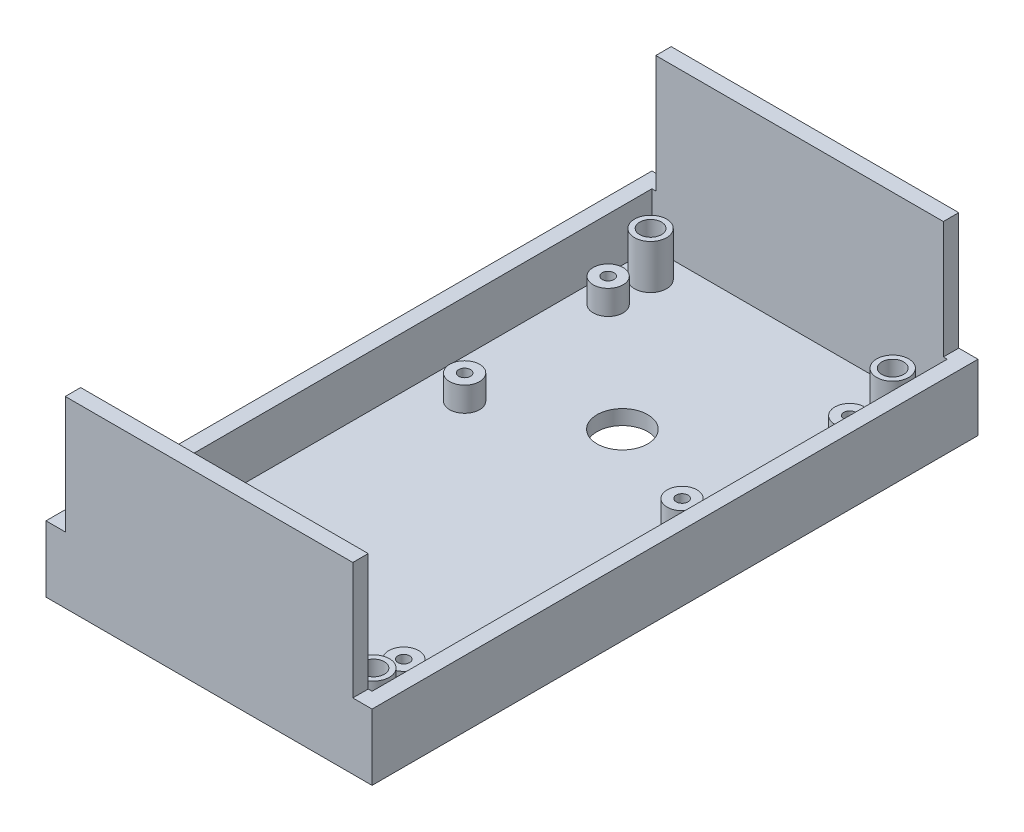
from build123d import *

# Parameters (mm, degrees)
SKETCH1_W           = 64.516
SKETCH1_H           = 119.888
BOSS_EXTRUDE1_DEPTH = 13.081
SKETCH2_W           = 58.42
SKETCH2_H           = 113.792
CUT_EXTRUDE1_DEPTH  = 10.16
SKETCH3_W           = 56.896
SKETCH3_H           = 3.048
BOSS_EXTRUDE2_DEPTH = 23.2156
SKETCH4_R           = 2.9591
SKETCH4_R_2         = 1.1684
BOSS_EXTRUDE3_DEPTH = 4.826
SKETCH5_R           = 5.0165
CUT_EXTRUDE2_DEPTH  = 141.176237199
SKETCH6_R           = 3.175
SKETCH6_R_2         = 2.159
BOSS_EXTRUDE4_DEPTH = 8.763
SKETCH6_2_R         = 2.159
CUT_EXTRUDE3_DEPTH  = 141.176237199


with BuildPart() as part:
    # Sketch1 → Boss-Extrude1 (new body)
    with BuildSketch(Plane(origin=(0, 0, 0), x_dir=(1, 0, 0), z_dir=(0, 1, 0))):
        with Locations((32.258, 59.944)):
            Rectangle(SKETCH1_W, SKETCH1_H)
    extrude(amount=BOSS_EXTRUDE1_DEPTH)

    # Sketch2 → Cut-Extrude1 (cut)
    with BuildSketch(Plane(origin=(0, 13.081, 0), x_dir=(1, 0, 0), z_dir=(0, 1, 0))):
        with Locations((32.258, 59.944)):
            Rectangle(SKETCH2_W, SKETCH2_H)
    extrude(amount=-CUT_EXTRUDE1_DEPTH, mode=Mode.SUBTRACT)

    # Sketch3 → Boss-Extrude2 (add)
    with BuildSketch(Plane(origin=(0, 13.081, 0), x_dir=(1, 0, 0), z_dir=(0, 1, 0))):
        with Locations((32.258, 118.364)):
            Rectangle(SKETCH3_W, SKETCH3_H)
        with Locations((32.258, 1.524)):
            Rectangle(SKETCH3_W, SKETCH3_H)
    extrude(amount=BOSS_EXTRUDE2_DEPTH)

    # Sketch4 → Boss-Extrude3 (add)
    # profile 1 of 6: a face of its own
    with BuildSketch(Plane(origin=(0, 2.921, 0), x_dir=(1, 0, 0), z_dir=(0, 1, 0))):
        with Locations((8.3566, 102.87)):
            Circle(SKETCH4_R)
        with Locations((8.3566, 102.87)):
            Circle(SKETCH4_R_2, mode=Mode.SUBTRACT)
    # profile 2 of 6: a face of its own
    with BuildSketch(Plane(origin=(0, 2.921, 0), x_dir=(1, 0, 0), z_dir=(0, 1, 0))):
        with Locations((56.1594, 102.87)):
            Circle(SKETCH4_R)
        with Locations((56.1594, 102.87)):
            Circle(SKETCH4_R_2, mode=Mode.SUBTRACT)
    # profile 3 of 6: a face of its own
    with BuildSketch(Plane(origin=(0, 2.921, 0), x_dir=(1, 0, 0), z_dir=(0, 1, 0))):
        with Locations((10.7442, 72.0852)):
            Circle(SKETCH4_R)
        with Locations((10.7442, 72.0852)):
            Circle(SKETCH4_R_2, mode=Mode.SUBTRACT)
    # profile 4 of 6: a face of its own
    with BuildSketch(Plane(origin=(0, 2.921, 0), x_dir=(1, 0, 0), z_dir=(0, 1, 0))):
        with Locations((53.7718, 72.0852)):
            Circle(SKETCH4_R)
        with Locations((53.7718, 72.0852)):
            Circle(SKETCH4_R_2, mode=Mode.SUBTRACT)
    # profile 5 of 6: a face of its own
    with BuildSketch(Plane(origin=(0, 2.921, 0), x_dir=(1, 0, 0), z_dir=(0, 1, 0))):
        with Locations((10.7442, 17.018)):
            Circle(SKETCH4_R)
        with Locations((10.7442, 17.018)):
            Circle(SKETCH4_R_2, mode=Mode.SUBTRACT)
    # profile 6 of 6: a face of its own
    with BuildSketch(Plane(origin=(0, 2.921, 0), x_dir=(1, 0, 0), z_dir=(0, 1, 0))):
        with Locations((53.7718, 17.018)):
            Circle(SKETCH4_R)
        with Locations((53.7718, 17.018)):
            Circle(SKETCH4_R_2, mode=Mode.SUBTRACT)
    extrude(amount=BOSS_EXTRUDE3_DEPTH)

    # Sketch5 → Cut-Extrude2 (cut, through all)
    with BuildSketch(Plane(origin=(0, 2.921, 0), x_dir=(1, 0, 0), z_dir=(0, 1, 0))):
        with Locations((31.1785, 82.8675)):
            Circle(SKETCH5_R)
    extrude(amount=-CUT_EXTRUDE2_DEPTH, mode=Mode.SUBTRACT)

    # Sketch6 → Boss-Extrude4 (add)
    # profile 1 of 4: a face of its own
    with BuildSketch(Plane(origin=(0, 2.921, 0), x_dir=(1, 0, 0), z_dir=(0, 1, 0))):
        with Locations((8.3058, 111.3155)):
            Circle(SKETCH6_R)
        with Locations((8.3058, 111.3155)):
            Circle(SKETCH6_R_2, mode=Mode.SUBTRACT)
    # profile 2 of 4: a face of its own
    with BuildSketch(Plane(origin=(0, 2.921, 0), x_dir=(1, 0, 0), z_dir=(0, 1, 0))):
        with Locations((56.2102, 111.3155)):
            Circle(SKETCH6_R)
        with Locations((56.2102, 111.3155)):
            Circle(SKETCH6_R_2, mode=Mode.SUBTRACT)
    # profile 3 of 4: a face of its own
    with BuildSketch(Plane(origin=(0, 2.921, 0), x_dir=(1, 0, 0), z_dir=(0, 1, 0))):
        with Locations((8.3058, 8.5725)):
            Circle(SKETCH6_R)
        with Locations((8.3058, 8.5725)):
            Circle(SKETCH6_R_2, mode=Mode.SUBTRACT)
    # profile 4 of 4: a face of its own
    with BuildSketch(Plane(origin=(0, 2.921, 0), x_dir=(1, 0, 0), z_dir=(0, 1, 0))):
        with Locations((56.2102, 8.5725)):
            Circle(SKETCH6_R)
        with Locations((56.2102, 8.5725)):
            Circle(SKETCH6_R_2, mode=Mode.SUBTRACT)
    extrude(amount=BOSS_EXTRUDE4_DEPTH)

    # Sketch6<2> → Cut-Extrude3 (cut, through all)
    with BuildSketch(Plane(origin=(0, 2.921, 0), x_dir=(1, 0, 0), z_dir=(0, 1, 0))):
        with Locations((8.3058, 111.3155)):
            Circle(SKETCH6_2_R)
        with Locations((56.2102, 111.3155)):
            Circle(SKETCH6_2_R)
        with Locations((8.3058, 8.5725)):
            Circle(SKETCH6_2_R)
        with Locations((56.2102, 8.5725)):
            Circle(SKETCH6_2_R)
    extrude(amount=-CUT_EXTRUDE3_DEPTH, mode=Mode.SUBTRACT)


solid = part.part
